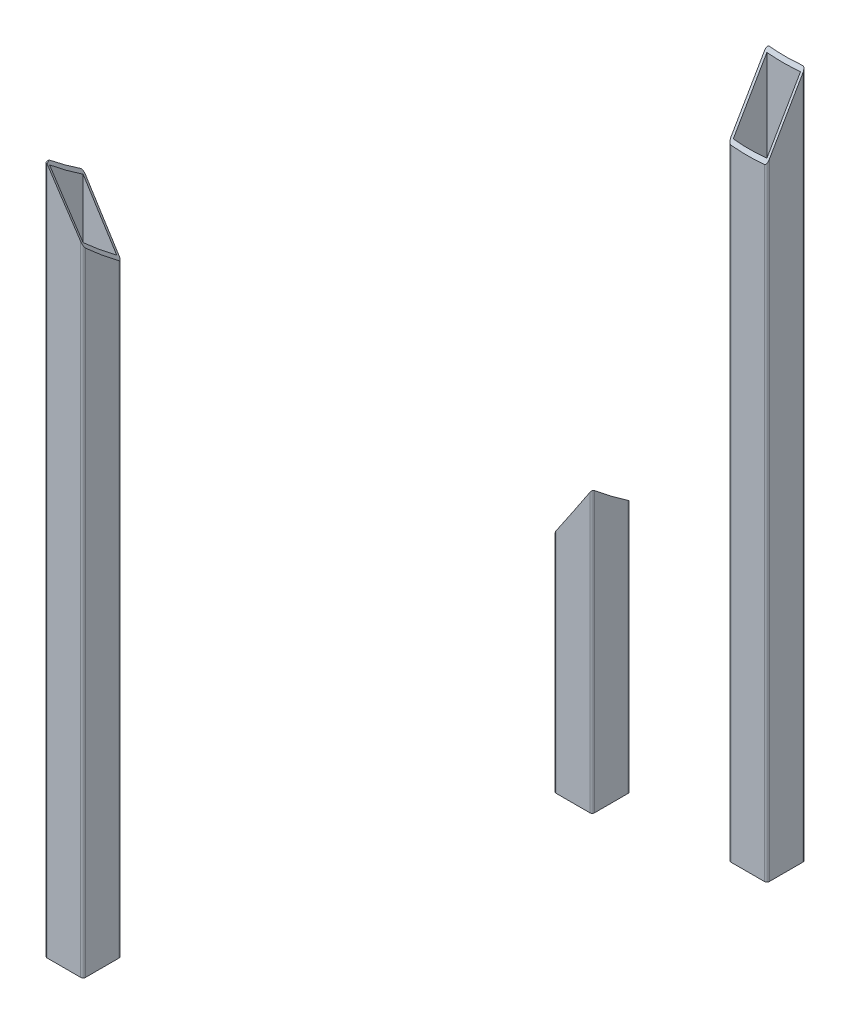
from build123d import *

# Parameters (mm, degrees)
CROQUIS11_W                   = 22.225
CROQUIS11_H                   = 22.225
TUBO_CUADRADA_1_X_1_1_DEPTH   = 455
CROQUIS11_ON_SEGMENT_2_W      = 22.225
CROQUIS11_ON_SEGMENT_2_H      = 22.225
TUBO_CUADRADA_1_X_1_1_2_DEPTH = 455
CROQUIS11_ON_SEGMENT_3_W      = 22.225
CROQUIS11_ON_SEGMENT_3_H      = 22.225
TUBO_CUADRADA_1_X_1_1_3_DEPTH = 455
CROQUIS14_W                   = 32.37721909
CROQUIS14_H                   = 31.982194398
CORTAR_EXTRUIR1_DEPTH         = 481
CROQUIS16_W                   = 22.225
CROQUIS16_H                   = 22.225
SALIENTE_EXTRUIR1_DEPTH       = 185


with BuildPart() as part:
    # Croquis11 → Tubo cuadrada 1 X 1(1) (new body)
    with BuildSketch(Plane(origin=(171.928790355, 0, 87.027472945), x_dir=(1, 0, 0), z_dir=(0, -1, 0))):
        with BuildLine():
            Line((11.1125, 12.7), (-11.1125, 12.7))
            ThreePointArc((-11.1125, 12.7), (-12.235032015, 12.235032015), (-12.7, 11.1125))
            Line((-12.7, 11.1125), (-12.7, -11.1125))
            ThreePointArc((-12.7, -11.1125), (-12.235032015, -12.235032015), (-11.1125, -12.7))
            Line((-11.1125, -12.7), (11.1125, -12.7))
            ThreePointArc((11.1125, -12.7), (12.235032015, -12.235032015), (12.7, -11.1125))
            Line((12.7, -11.1125), (12.7, 11.1125))
            ThreePointArc((12.7, 11.1125), (12.235032015, 12.235032015), (11.1125, 12.7))
        make_face()
        Rectangle(CROQUIS11_W, CROQUIS11_H, mode=Mode.SUBTRACT)
    extrude(amount=TUBO_CUADRADA_1_X_1_1_DEPTH)

    # Croquis14 → Cortar-Extruir1 (cut)
    with BuildSketch(Plane.XZ.offset(455)):
        with Locations((172.035359018, 86.366428401)):
            Rectangle(CROQUIS14_W, CROQUIS14_H)
    extrude(amount=-CORTAR_EXTRUIR1_DEPTH, mode=Mode.SUBTRACT)


with BuildPart() as body_2:
    # Croquis11 on segment 2 (carried to segment 2) → Tubo cuadrada 1 X 1_1 2 (new body)
    with BuildSketch(Plane(origin=(-171.240476171, 0, 88.37414396), x_dir=(1, 0, 0), z_dir=(0, -1, 0))):
        with BuildLine():
            Line((11.1125, 12.7), (-11.1125, 12.7))
            ThreePointArc((-11.1125, 12.7), (-12.235032015, 12.235032015), (-12.7, 11.1125))
            Line((-12.7, 11.1125), (-12.7, -11.1125))
            ThreePointArc((-12.7, -11.1125), (-12.235032015, -12.235032015), (-11.1125, -12.7))
            Line((-11.1125, -12.7), (11.1125, -12.7))
            ThreePointArc((11.1125, -12.7), (12.235032015, -12.235032015), (12.7, -11.1125))
            Line((12.7, -11.1125), (12.7, 11.1125))
            ThreePointArc((12.7, 11.1125), (12.235032015, 12.235032015), (11.1125, 12.7))
        make_face()
        Rectangle(CROQUIS11_ON_SEGMENT_2_W, CROQUIS11_ON_SEGMENT_2_H, mode=Mode.SUBTRACT)
    extrude(amount=TUBO_CUADRADA_1_X_1_1_2_DEPTH)


with BuildPart() as body_3:
    # Croquis11 on segment 3 (carried to segment 3) → Tubo cuadrada 1 X 1_1 3 (new body)
    with BuildSketch(Plane(origin=(0, 0, -192.7), x_dir=(1, 0, 0), z_dir=(0, -1, 0))):
        with BuildLine():
            Line((11.1125, 12.7), (-11.1125, 12.7))
            ThreePointArc((-11.1125, 12.7), (-12.235032015, 12.235032015), (-12.7, 11.1125))
            Line((-12.7, 11.1125), (-12.7, -11.1125))
            ThreePointArc((-12.7, -11.1125), (-12.235032015, -12.235032015), (-11.1125, -12.7))
            Line((-11.1125, -12.7), (11.1125, -12.7))
            ThreePointArc((11.1125, -12.7), (12.235032015, -12.235032015), (12.7, -11.1125))
            Line((12.7, -11.1125), (12.7, 11.1125))
            ThreePointArc((12.7, 11.1125), (12.235032015, 12.235032015), (11.1125, 12.7))
        make_face()
        Rectangle(CROQUIS11_ON_SEGMENT_3_W, CROQUIS11_ON_SEGMENT_3_H, mode=Mode.SUBTRACT)
    extrude(amount=TUBO_CUADRADA_1_X_1_1_3_DEPTH)


with BuildPart() as body_3_2:
    # Croquis16 → Saliente-Extruir1 (new body)
    with BuildSketch(Plane(origin=(0, -192.3, 0), x_dir=(1, 0, 0), z_dir=(0, 1, 0))):
        with BuildLine():
            Line((176.633769577, -75.67414396), (154.408769577, -75.67414396))
            ThreePointArc((154.408769577, -75.67414396), (153.286237562, -76.139111945), (152.821269577, -77.26164396))
            Line((152.821269577, -77.26164396), (152.821269577, -99.48664396))
            ThreePointArc((152.821269577, -99.48664396), (153.286237562, -100.609175975), (154.408769577, -101.07414396))
            Line((154.408769577, -101.07414396), (176.633769577, -101.07414396))
            ThreePointArc((176.633769577, -101.07414396), (177.756301592, -100.609175975), (178.221269577, -99.48664396))
            Line((178.221269577, -99.48664396), (178.221269577, -77.26164396))
            ThreePointArc((178.221269577, -77.26164396), (177.756301592, -76.139111945), (176.633769577, -75.67414396))
        make_face()
        with Locations((165.521269577, -88.37414396)):
            Rectangle(CROQUIS16_W, CROQUIS16_H, mode=Mode.SUBTRACT)
    extrude(amount=SALIENTE_EXTRUIR1_DEPTH)


with BuildPart() as cortar_revoluci_n1_tool:
    # Croquis13 → Cortar-Revolución1 (revolve)
    with BuildSketch(Plane.XY.offset(1.825232316)):
        Polygon((0, 0), (0, -359.688544551), (-207.666278021, 0), align=None)
    revolve(axis=Axis((0, 0, 1.825232316), (0, -1, 0)))


with BuildPart() as body_2_1:
    add(body_2.part)

    # Cortar-Revolución1: cut by cortar_revoluci_n1_tool
    add(cortar_revoluci_n1_tool.part, mode=Mode.SUBTRACT)


with BuildPart() as body_3_1:
    add(body_3.part)

    # Cortar-Revolución1: cut by cortar_revoluci_n1_tool
    add(cortar_revoluci_n1_tool.part, mode=Mode.SUBTRACT)


with BuildPart() as body_3_2_1:
    add(body_3_2.part)

    # Cortar-Revolución1: cut by cortar_revoluci_n1_tool
    add(cortar_revoluci_n1_tool.part, mode=Mode.SUBTRACT)


solid = Compound([body_2_1.part, body_3_1.part, body_3_2_1.part])
